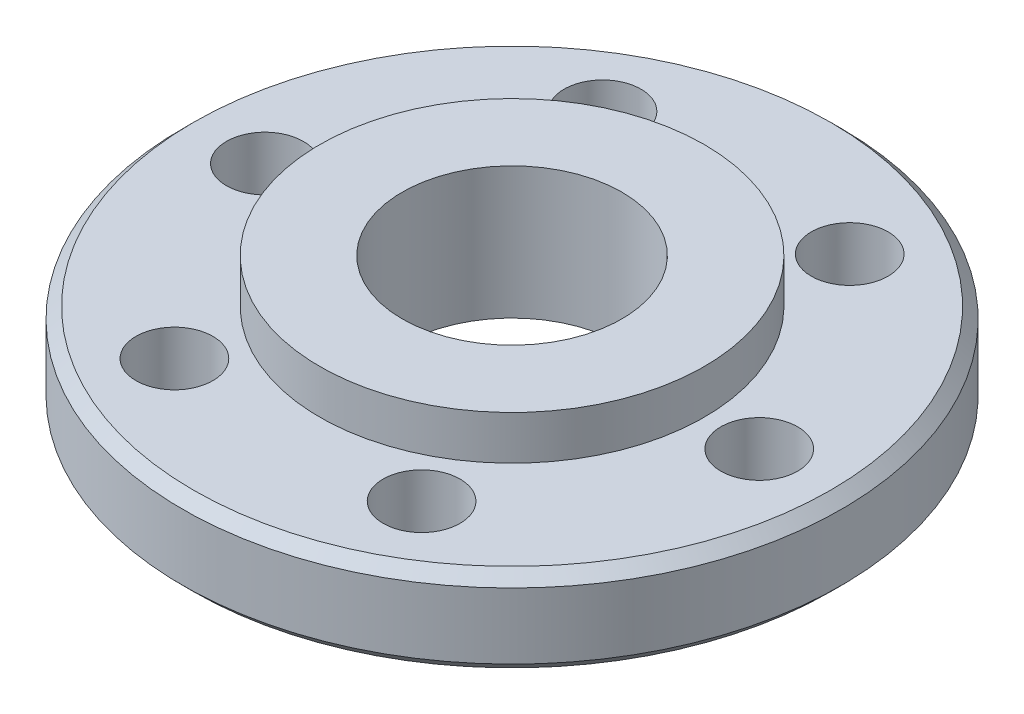
from build123d import *

# Parameters (mm, degrees)
SKETCH_2_R               = 7
CUT_EXTRUDE_1_DEPTH      = 89.18163074
PATTERN_CIRCULAR_1_COUNT = 6


with BuildPart() as part:
    # 草图1 → 旋转1 (revolve)
    with BuildSketch(Plane.XY, mode=Mode.PRIVATE) as revolve_1_sk:
        Polygon((20, 0), (58, 0), (60, 2), (60, 14), (58, 16), (35, 16), (35, 24), (20, 24), align=None)
    revolve(revolve_1_sk.sketch.rotate(Axis((0, -10, 0), (0, 1, 0)), 90), axis=Axis((0, -10, 0), (0, 1, 0)))

    # 草图2 → 切除-拉伸1 (cut, through all)
    with BuildSketch(Plane(origin=(0, 0, 0), x_dir=(1, 0, 0), z_dir=(0, 1, 0))):
        with Locations(Location((45, 0, 0), (0, 0, 270))):
            Circle(SKETCH_2_R)
    cut_extrude_1 = extrude(amount=CUT_EXTRUDE_1_DEPTH, mode=Mode.SUBTRACT)

    # 阵列(圆周)1: 切除-拉伸1 ×6 about axis
    pattern_circular_1_axis = Axis((0, 0, 0), (0, 1, 0))
    for i in range(1, PATTERN_CIRCULAR_1_COUNT):
        add(cut_extrude_1.rotate(pattern_circular_1_axis, i * 360 / PATTERN_CIRCULAR_1_COUNT), mode=Mode.SUBTRACT)


solid = part.part
